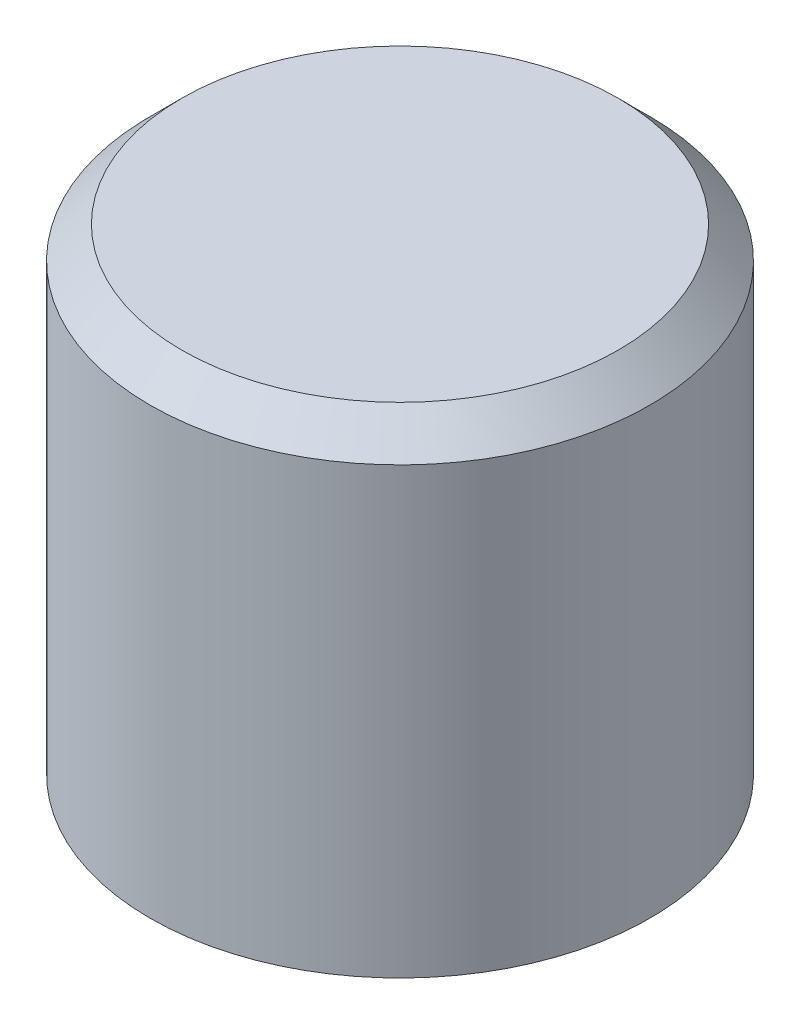
from build123d import *

# Parameters (mm, degrees)
SKETCH_1_R      = 7.875
EXTRUDE_1_DEPTH = 15
CHAMFER_1_SIZE  = 1


with BuildPart() as part:
    # Эскиз1 → Бобышка-Вытянуть1 (new body)
    with BuildSketch(Plane(origin=(0, 0, 0), x_dir=(1, 0, 0), z_dir=(0, 1, 0))):
        with Locations(Location((0, 0, 0), (0, 0, 270))):
            Circle(SKETCH_1_R)
    extrude(amount=EXTRUDE_1_DEPTH)

    # Фаска1
    chamfer_1_edges = [part.edges().sort_by_distance(p)[0] for p in [
        (0, 15, -7.875),
    ]]
    chamfer(chamfer_1_edges, length=CHAMFER_1_SIZE)


solid = part.part
